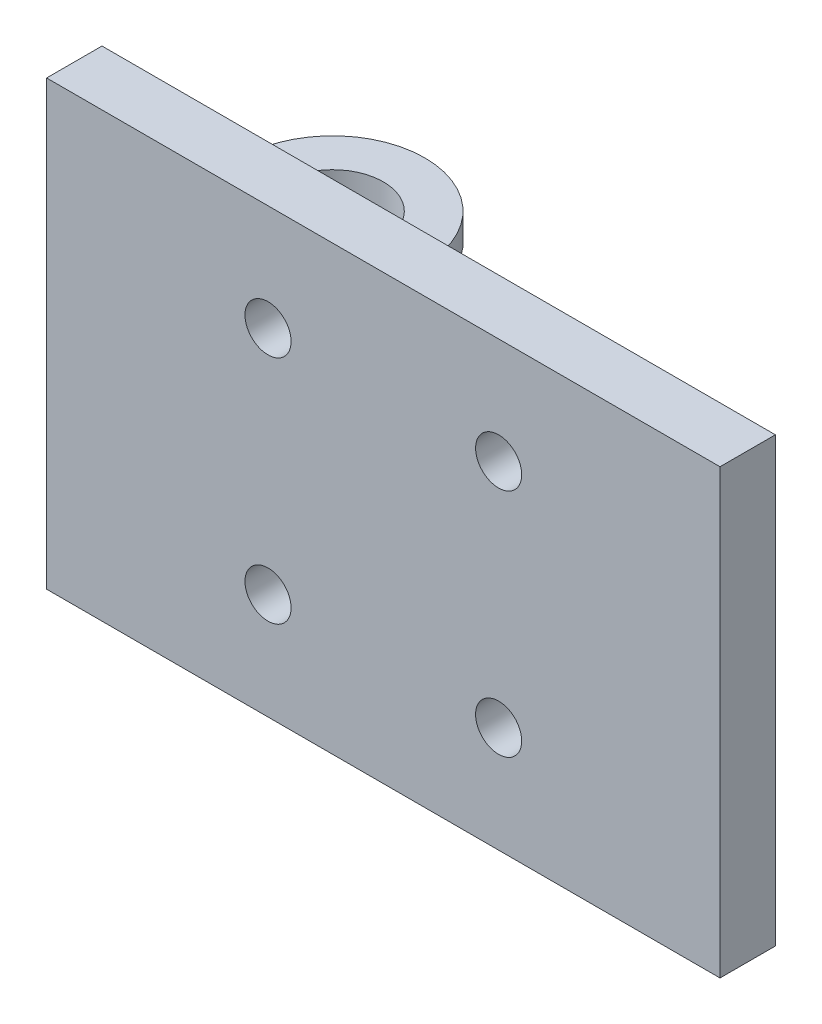
from build123d import *

# Parameters (mm, degrees)
SKETCH_1_W      = 73
SKETCH_1_H      = 48
SKETCH_1_R      = 2.5
EXTRUDE_1_DEPTH = 6
EXTRUDE_START   = 3
SKETCH_3_R      = 5.5
EXTRUDE_2_DEPTH = 3
SCALE_1_SCALE   = 0.3


with BuildPart() as part:
    # 草图1 → 凸台-拉伸1 (new body)
    with BuildSketch(Plane.XY):
        Rectangle(SKETCH_1_W, SKETCH_1_H)
        with Locations((-12.5, 12.5)):
            Circle(SKETCH_1_R, mode=Mode.SUBTRACT)
        with Locations((12.5, 12.5)):
            Circle(SKETCH_1_R, mode=Mode.SUBTRACT)
        with Locations((12.5, -12.5)):
            Circle(SKETCH_1_R, mode=Mode.SUBTRACT)
        with Locations((-12.5, -12.5)):
            Circle(SKETCH_1_R, mode=Mode.SUBTRACT)
    extrude(amount=EXTRUDE_1_DEPTH)


with BuildPart() as body_2:
    # 草图3 → 凸台-拉伸2 (new body)
    with BuildSketch(Plane(origin=(0, 0, 0), x_dir=(1, 0, 0), z_dir=(0, 1, 0)).offset(EXTRUDE_START)):
        with BuildLine():
            Line((-36.5, 0), (-16.5, 0))
            Line((-16.5, 0), (-16.5, 15))
            ThreePointArc((-16.5, 15), (-26.5, 25), (-36.5, 15))
            Line((-36.5, 15), (-36.5, 0))
        make_face()
        with Locations(Location((-26.5, 15, 0), (0, 0, 270))):
            Circle(SKETCH_3_R, mode=Mode.SUBTRACT)
    extrude(amount=EXTRUDE_2_DEPTH)


with BuildPart() as body_3:
    # 镜向1: mirrored copy
    add(body_2.part.mirror(Plane.ZX))


with BuildPart() as body_3_1:
    # 缩放比例1: scaled about (0, 0, 0)
    add(body_3.part.scale(SCALE_1_SCALE))


with BuildPart() as body_2_1:
    # 缩放比例1: scaled about (0, 0, 0)
    add(body_2.part.scale(SCALE_1_SCALE))


with BuildPart() as part_1:
    # 缩放比例1: scaled about (0, 0, 0)
    add(part.part.scale(SCALE_1_SCALE))


solid = Compound([body_3_1.part, body_2_1.part, part_1.part])
